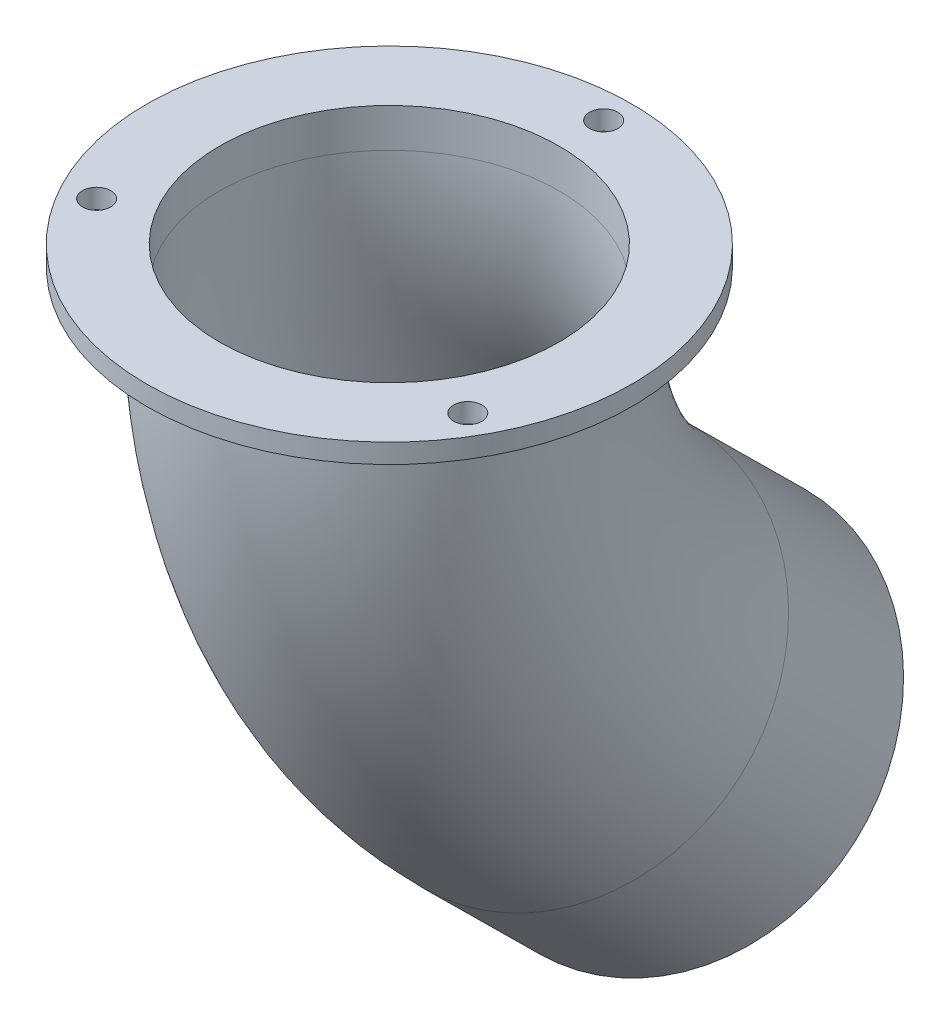
from build123d import *
from build123d.topology import SkipClean

# Parameters (mm, degrees)
SKETCH2_R           = 23.4
SKETCH2_R_2         = 21
SKETCH4_R           = 30
SKETCH4_R_2         = 21
SKETCH4_R_3         = 1.75
BOSS_EXTRUDE1_DEPTH = 2.4


with BuildPart() as part:
    # Sweep1: sweep along a path in Sketch1
    with BuildLine(Plane(origin=(0, 0, 0), x_dir=(0, 0, -1), z_dir=(1, 0, 0))) as sweep1_path:
        Line((0, 0), (0, -2.4))
        ThreePointArc((0, -2.4), (5.398568754, -29.356540598), (20.761573743, -52.155174402))
        Line((20.761573743, -52.155174402), (34.977337858, -66.223296189))
    # Sketch2 → Sweep1 (sweep)
    with BuildSketch(Plane(origin=(0, 0, 0), x_dir=(1, 0, 0), z_dir=(0, 1, 0))):
        Circle(SKETCH2_R)
        Circle(SKETCH2_R_2, mode=Mode.SUBTRACT)
    sweep(path=sweep1_path.line)

    # Sketch4 → Boss-Extrude1 (add)
    with SkipClean():  # the faces are left unmerged after this step: merging them gives an invalid solid
        with BuildSketch(Plane(origin=(0, 0, 0), x_dir=(1, 0, 0), z_dir=(0, 1, 0))):
            with Locations(Location((0, 0, 0), (0, 0, 270))):
                Circle(SKETCH4_R)
            with Locations(Location((0, 0, 0), (0, 0, 270))):
                Circle(SKETCH4_R_2, mode=Mode.SUBTRACT)
            with Locations(Location((0, 26.5, 0), (0, 0, 270))):
                Circle(SKETCH4_R_3, mode=Mode.SUBTRACT)
            with Locations(Location((22.9496732, -13.25, 0), (0, 0, 270))):
                Circle(SKETCH4_R_3, mode=Mode.SUBTRACT)
            with Locations(Location((-22.9496732, -13.25, 0), (0, 0, 270))):
                Circle(SKETCH4_R_3, mode=Mode.SUBTRACT)
        extrude(amount=BOSS_EXTRUDE1_DEPTH)


solid = part.part
